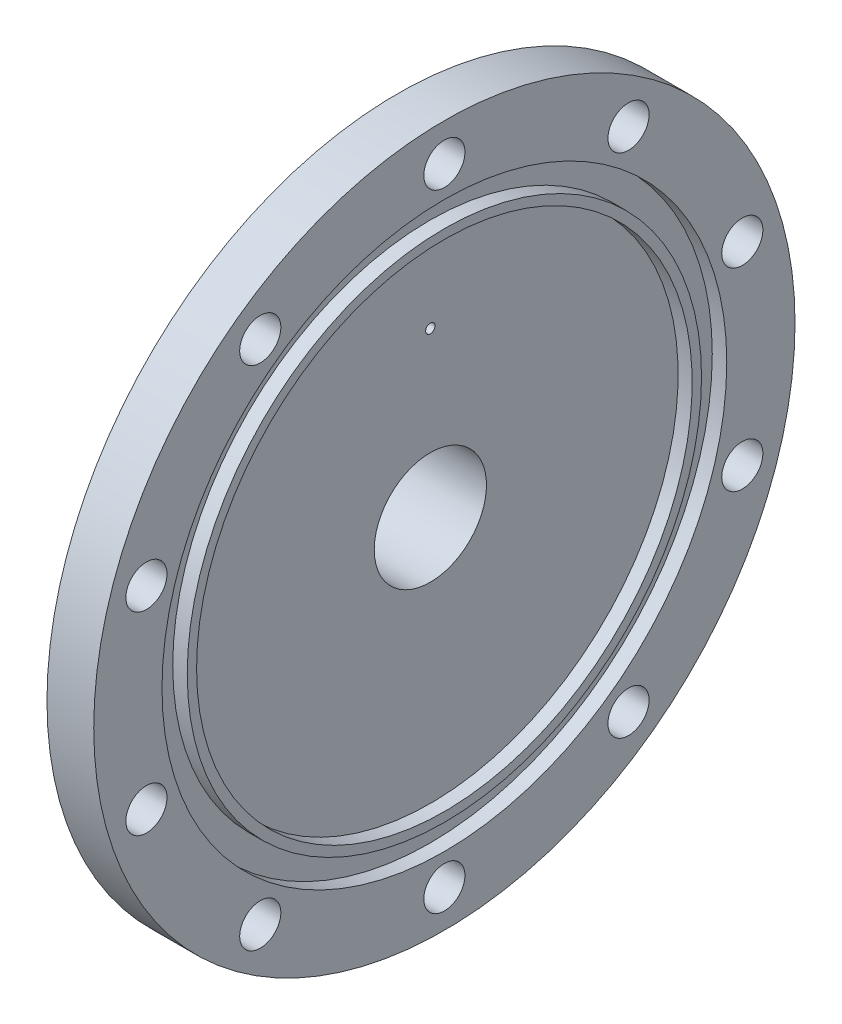
from build123d import *

# Parameters (mm, degrees)
SKETCH2_R           = 2.1
CUT_EXTRUDE1_DEPTH  = 6
CIRPATTERN1_COUNT   = 6
CUT_EXTRUDE2_REACH  = 108.536
SKETCH3_R           = 4.4
CIRPATTERN2_COUNT   = 10
BOSS_EXTRUDE1_START = 10
SKETCH4_R           = 5.5
BOSS_EXTRUDE1_DEPTH = 10
SKETCH5_R           = 5.5
CUT_EXTRUDE3_DEPTH  = 3
CUT_EXTRUDE4_REACH  = 108.86
SKETCH6_R           = 1


with BuildPart() as part:
    # Sketch1 → Revolve1 (revolve)
    with BuildSketch(Plane.XY, mode=Mode.PRIVATE) as revolve1_sk:
        Polygon((0, 12), (17, 12), (17, 53), (20, 53), (20, 55), (16.9, 55), (16.9, 60.4), (20, 60.4), (20, 75), (10, 75), (10, 24), (0, 24), align=None)
    revolve(revolve1_sk.sketch.rotate(Axis((0, 0, 0), (1, 0, 0)), 90), axis=Axis((0, 0, 0), (1, 0, 0)))

    # Sketch2 → Cut-Extrude1 (cut)
    with BuildSketch(Plane.ZY):
        with Locations((0, 18)):
            Circle(SKETCH2_R)
    cut_extrude1 = extrude(amount=-CUT_EXTRUDE1_DEPTH, mode=Mode.SUBTRACT)

    # CirPattern1: Cut-Extrude1 ×6 about axis
    cirpattern1_axis = Axis((0, 0, 0), (1, 0, 0))
    for i in range(1, CIRPATTERN1_COUNT):
        add(cut_extrude1.rotate(cirpattern1_axis, i * 360 / CIRPATTERN1_COUNT), mode=Mode.SUBTRACT)

    # Sketch3 → Cut-Extrude2 (cut, up to next)
    with BuildSketch(Plane.ZY.offset(-10), mode=Mode.PRIVATE) as cut_extrude2_sk1:
        with Locations((0, 67)):
            Circle(SKETCH3_R)
    cut_extrude2_tool1 = extrude(cut_extrude2_sk1.sketch, amount=-CUT_EXTRUDE2_REACH, mode=Mode.PRIVATE) & part.part
    cut_extrude2 = cut_extrude2_tool1.solids().sort_by_distance((10, 67, 0))[0]
    add(cut_extrude2, mode=Mode.SUBTRACT)

    # CirPattern2: Cut-Extrude2 ×10 about axis
    cirpattern2_axis = Axis((0, 0, 0), (1, 0, 0))
    for i in range(1, CIRPATTERN2_COUNT):
        add(cut_extrude2.rotate(cirpattern2_axis, i * 360 / CIRPATTERN2_COUNT), mode=Mode.SUBTRACT)

    # Sketch4 → Boss-Extrude1 (add)
    with BuildSketch(Plane.ZY.offset(-10).offset(BOSS_EXTRUDE1_START)):
        with BuildLine():
            Line((-21.84352517, 9.942857143), (-8.64639538, 38.935714286))
            ThreePointArc((-8.64639538, 38.935714286), (0, 44.5), (8.64639538, 38.935714286))
            Line((8.64639538, 38.935714286), (21.84352517, 9.942857143))
            ThreePointArc((21.84352517, 9.942857143), (0, 24), (-21.84352517, 9.942857143))
        make_face()
        with Locations((0, 35)):
            Circle(SKETCH4_R, mode=Mode.SUBTRACT)
    extrude(amount=-BOSS_EXTRUDE1_DEPTH)

    # Sketch5 → Cut-Extrude3 (cut)
    with BuildSketch(Plane.ZY.offset(-10)):
        with Locations((0, 35)):
            Circle(SKETCH5_R)
    extrude(amount=-CUT_EXTRUDE3_DEPTH, mode=Mode.SUBTRACT)

    # Sketch6 → Cut-Extrude4 (cut, up to next)
    with BuildSketch(Plane.ZY.offset(-13), mode=Mode.PRIVATE) as cut_extrude4_sk1:
        with Locations((0, 35)):
            Circle(SKETCH6_R)
    cut_extrude4_tool1 = extrude(cut_extrude4_sk1.sketch, amount=-CUT_EXTRUDE4_REACH, mode=Mode.PRIVATE) & part.part
    add(cut_extrude4_tool1.solids().sort_by_distance((13, 35, 0))[0], mode=Mode.SUBTRACT)


solid = part.part
